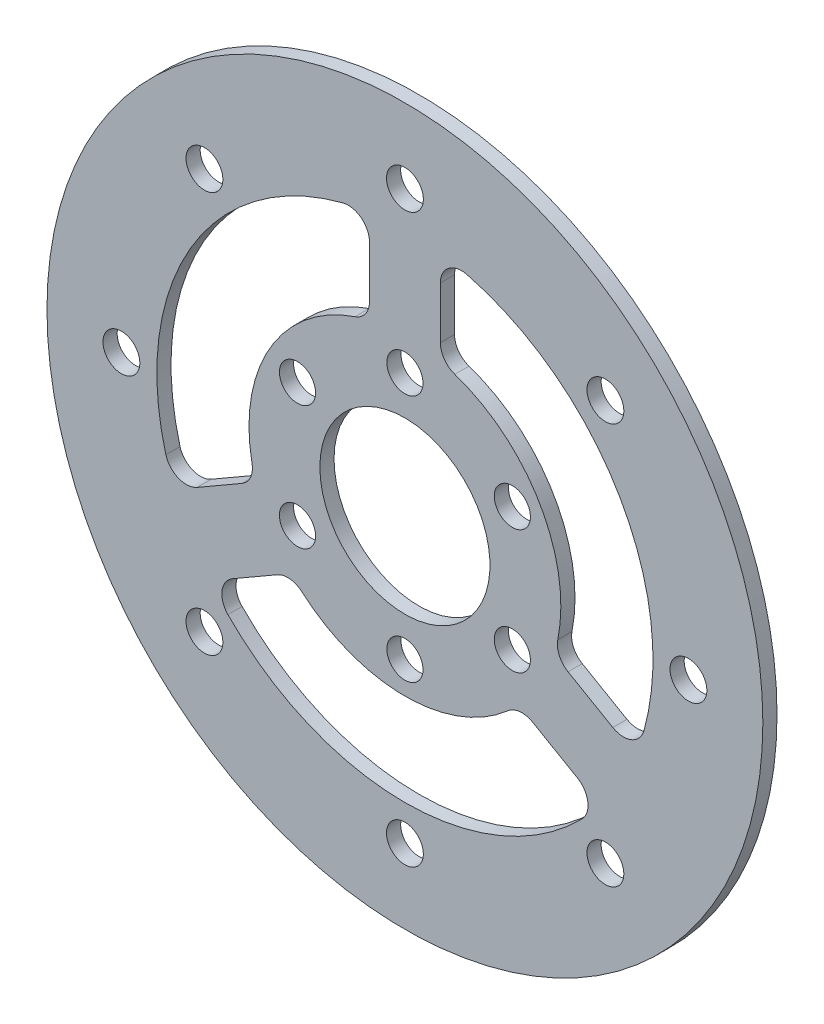
from build123d import *

# Parameters (mm, degrees)
SKETCH_1_R      = 50.5
SKETCH_1_R_2    = 2.6
SKETCH_1_R_3    = 35
EXTRUDE_1_DEPTH = 2
SKETCH_3_R      = 2.55
SKETCH_3_R_2    = 12
EXTRUDE_4_DEPTH = 2
FILLET_2_R      = 3


with BuildPart() as part:
    # 草图1 → 凸台-拉伸1 (new body)
    with BuildSketch(Plane.XY):
        Circle(SKETCH_1_R)
        with Locations((0, 40)):
            Circle(SKETCH_1_R_2, mode=Mode.SUBTRACT)
        Circle(SKETCH_1_R_3, mode=Mode.SUBTRACT)
        with Locations((28.284271247, 28.284271247)):
            Circle(SKETCH_1_R_2, mode=Mode.SUBTRACT)
        with Locations((40, 0)):
            Circle(SKETCH_1_R_2, mode=Mode.SUBTRACT)
        with Locations((28.284271247, -28.284271247)):
            Circle(SKETCH_1_R_2, mode=Mode.SUBTRACT)
        with Locations((0, -40)):
            Circle(SKETCH_1_R_2, mode=Mode.SUBTRACT)
        with Locations((-28.284271247, -28.284271247)):
            Circle(SKETCH_1_R_2, mode=Mode.SUBTRACT)
        with Locations((-40, 0)):
            Circle(SKETCH_1_R_2, mode=Mode.SUBTRACT)
        with Locations((-28.284271247, 28.284271247)):
            Circle(SKETCH_1_R_2, mode=Mode.SUBTRACT)
    extrude(amount=EXTRUDE_1_DEPTH)

    # 草图3 → 凸台-拉伸4 (add)
    with BuildSketch(Plane(origin=(0, 0, 0), x_dir=(-1, 0, 0), z_dir=(0, 0, -1))):
        with BuildLine():
            Line((-5, 34.641016151), (-5, 21.424285286))
            ThreePointArc((-5, 21.424285286), (-19.052558883, 11), (-21.053975315, -6.382015624))
            Line((-21.053975315, -6.382015624), (-32.5, -12.990381057))
            ThreePointArc((-32.5, -12.990381057), (-30.310889132, -17.5), (-27.5, -21.650635095))
            Line((-27.5, -21.650635095), (-16.053975315, -15.042269662))
            ThreePointArc((-16.053975315, -15.042269662), (0, -22), (16.053975315, -15.042269662))
            Line((16.053975315, -15.042269662), (27.5, -21.650635095))
            ThreePointArc((27.5, -21.650635095), (30.310889132, -17.5), (32.5, -12.990381057))
            Line((32.5, -12.990381057), (21.053975315, -6.382015624))
            ThreePointArc((21.053975315, -6.382015624), (19.052558883, 11), (5, 21.424285286))
            Line((5, 21.424285286), (5, 34.641016151))
            ThreePointArc((5, 34.641016151), (0, 35), (-5, 34.641016151))
        make_face()
        with Locations((0, 17.5)):
            Circle(SKETCH_3_R, mode=Mode.SUBTRACT)
        with Locations((0, -17.5)):
            Circle(SKETCH_3_R, mode=Mode.SUBTRACT)
        with Locations((-15.155444566, -8.75)):
            Circle(SKETCH_3_R, mode=Mode.SUBTRACT)
        with Locations((15.155444566, -8.75)):
            Circle(SKETCH_3_R, mode=Mode.SUBTRACT)
        with Locations((-15.155444566, 8.75)):
            Circle(SKETCH_3_R, mode=Mode.SUBTRACT)
        Circle(SKETCH_3_R_2, mode=Mode.SUBTRACT)
        with Locations((15.155444566, 8.75)):
            Circle(SKETCH_3_R, mode=Mode.SUBTRACT)
    extrude(amount=-EXTRUDE_4_DEPTH)

    # 圆角2
    fillet_2_edges = [part.edges().sort_by_distance(p)[0] for p in [
        (5, 21.424285286, 1),
        (5, 34.641016151, 1),
        (-5, 34.641016151, 1),
        (-5, 21.424285286, 1),
        (-21.053975315, -6.382015624, 1),
        (-32.5, -12.990381057, 1),
        (-27.5, -21.650635095, 1),
        (-16.053975315, -15.042269662, 1),
        (16.053975315, -15.042269662, 1),
        (27.5, -21.650635095, 1),
        (32.5, -12.990381057, 1),
        (21.053975315, -6.382015624, 1),
    ]]
    fillet(fillet_2_edges, radius=FILLET_2_R)


solid = part.part
